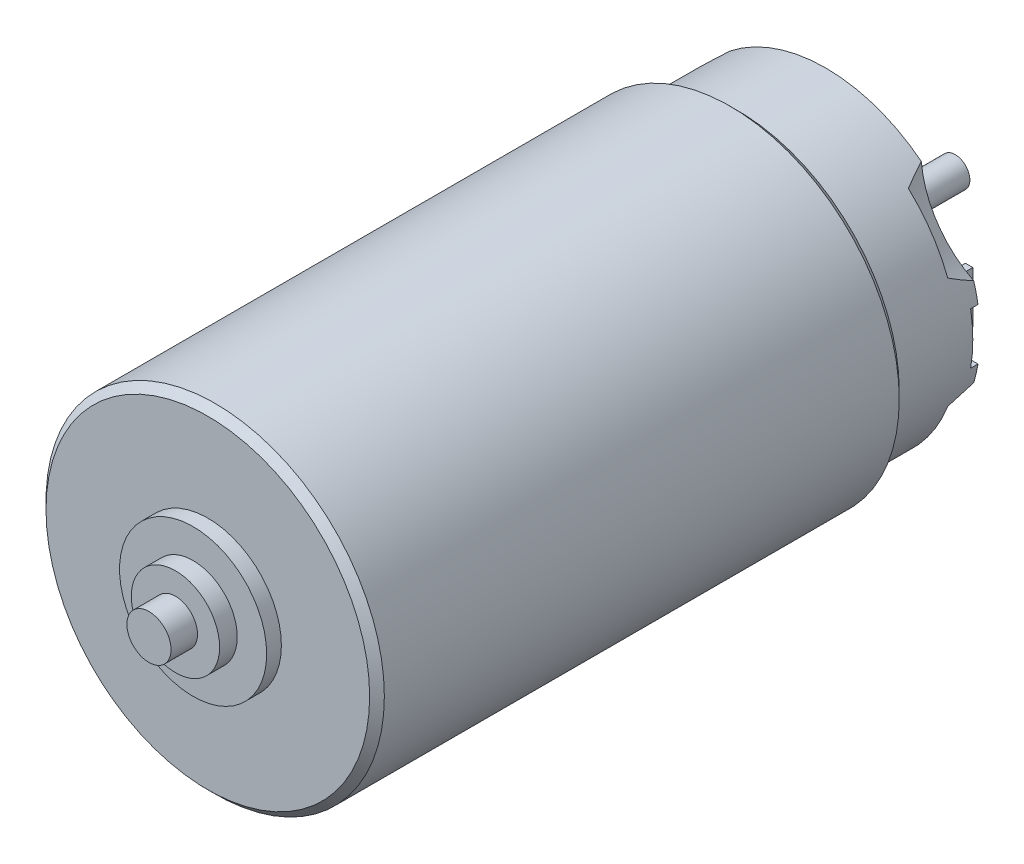
from build123d import *

# Parameters (mm, degrees)
CROQUIS1_R                      = 11.5
SALIENTE_EXTRUIR1_DEPTH         = 36
CROQUIS1_4_R                    = 5
SALIENTE_EXTRUIR2_DEPTH         = 1
CROQUIS1_5_R                    = 3
SALIENTE_EXTRUIR3_DEPTH         = 2.2
CROQUIS1_6_R                    = 1.5
SALIENTE_EXTRUIR4_DEPTH         = 4
CROQUIS3_R                      = 10.5
SALIENTE_EXTRUIR5_DEPTH         = 5
CROQUIS7_R                      = 10.5
SALIENTE_EXTRUIR10_DEPTH        = 1
CROQUIS3_6_R                    = 1
SALIENTE_EXTRUIR7_DEPTH         = 14.8
SALIENTE_EXTRUIR8_START         = 9.1
CROQUIS3_8_R                    = 3
SALIENTE_EXTRUIR8_DEPTH         = 9.1
CROQUIS3_9_R                    = 4.5
SALIENTE_EXTRUIR9_DEPTH         = 7.5
CROQUIS5_W                      = 0.55
CROQUIS5_H                      = 0.6
CORTAR_EXTRUIR1_DEPTH           = 1.5
CORTAR_EXTRUIR1_DRAFT           = -20
CORTAR_EXTRUIR1_PROFILE_2_DEPTH = 1.5
CORTAR_EXTRUIR1_PROFILE_2_DRAFT = -20
CORTAR_EXTRUIR1_PROFILE_3_DEPTH = 1.5
CORTAR_EXTRUIR1_PROFILE_3_DRAFT = -20
CORTAR_EXTRUIR1_PROFILE_4_DEPTH = 1.5
CORTAR_EXTRUIR1_PROFILE_4_DRAFT = -20
CHAFL_N1_SIZE                   = 0.5
CORTAR_EXTRUIR2_START           = -0.5
CORTAR_EXTRUIR2_DEPTH           = 0.5
CROQUIS10_W                     = 0.5
CROQUIS10_H                     = 3.5
SALIENTE_EXTRUIR11_DEPTH        = 2.5


with BuildPart() as part:
    # Croquis1 → Saliente-Extruir1 (new body)
    with BuildSketch(Plane.XY):
        Circle(CROQUIS1_R)
    extrude(amount=-SALIENTE_EXTRUIR1_DEPTH)

    # Croquis1<4> → Saliente-Extruir2 (add)
    with BuildSketch(Plane.XY):
        Circle(CROQUIS1_4_R)
    extrude(amount=SALIENTE_EXTRUIR2_DEPTH)

    # Croquis1<5> → Saliente-Extruir3 (add)
    with BuildSketch(Plane.XY):
        Circle(CROQUIS1_5_R)
    extrude(amount=SALIENTE_EXTRUIR3_DEPTH)

    # Croquis1<6> → Saliente-Extruir4 (add)
    with BuildSketch(Plane.XY):
        Circle(CROQUIS1_6_R)
    extrude(amount=SALIENTE_EXTRUIR4_DEPTH)

    # Croquis3 → Saliente-Extruir5 (add)
    with BuildSketch(Plane(origin=(0, 0, -36), x_dir=(-1, 0, 0), z_dir=(0, 0, -1))):
        Circle(CROQUIS3_R)
    extrude(amount=SALIENTE_EXTRUIR5_DEPTH)

    # Croquis3<6> → Saliente-Extruir7 (add)
    with BuildSketch(Plane(origin=(0, 0, -36), x_dir=(-1, 0, 0), z_dir=(0, 0, -1))):
        Circle(CROQUIS3_6_R)
    extrude(amount=SALIENTE_EXTRUIR7_DEPTH)

    # Croquis3<8> → Saliente-Extruir8 (add)
    with BuildSketch(Plane(origin=(0, 0, -36), x_dir=(-1, 0, 0), z_dir=(0, 0, -1)).offset(SALIENTE_EXTRUIR8_START)):
        with Locations(Location((0, 0, 0), (0, 0, 180))):
            Circle(CROQUIS3_8_R)
    extrude(amount=-SALIENTE_EXTRUIR8_DEPTH)

    # Croquis3<9> → Saliente-Extruir9 (add)
    with BuildSketch(Plane(origin=(0, 0, -36), x_dir=(-1, 0, 0), z_dir=(0, 0, -1))):
        Circle(CROQUIS3_9_R)
    extrude(amount=SALIENTE_EXTRUIR9_DEPTH)

    # Cortar-Barrer1: sweep along a curve in space
    with BuildLine() as cortar_barrer1_path:
        ThreePointArc((-3, 0, -45.1), (-2.121320344, 2.121320344, -45.1), (0, 3, -45.1))
        ThreePointArc((0, 3, -45.1), (2.121320344, 2.121320344, -45.1), (3, 0, -45.1))
        ThreePointArc((3, 0, -45.1), (2.121320344, -2.121320344, -45.1), (0, -3, -45.1))
        ThreePointArc((0, -3, -45.1), (-2.121320344, -2.121320344, -45.1), (-3, 0, -45.1))
    # Croquis5 → Cortar-Barrer1 (sweep, cut)
    with BuildSketch(Plane(origin=(0, 0, 0), x_dir=(0, 0, -1), z_dir=(1, 0, 0))):
        with Locations((43.775, 2.7)):
            Rectangle(CROQUIS5_W, CROQUIS5_H)
    sweep(path=cortar_barrer1_path.line, mode=Mode.SUBTRACT)


with BuildPart() as body_2:
    # Croquis7 → Saliente-Extruir10 (new body)
    with BuildSketch(Plane(origin=(0, 0, -41), x_dir=(-1, 0, 0), z_dir=(0, 0, -1))):
        Circle(CROQUIS7_R)
    extrude(amount=SALIENTE_EXTRUIR10_DEPTH)


with BuildPart() as cortar_extruir1_tool:
    # Croquis8 → Cortar-Extruir1 (with draft: the straight prism first)
    with BuildSketch(Plane(origin=(0, 0, -42), x_dir=(-1, 0, 0), z_dir=(0, 0, -1))):
        with BuildLine():
            ThreePointArc((-6.51000025, -9.479973457), (-7.597986649, -5.15921898), (-11.212760015, -2.554214724))
            ThreePointArc((-11.212760015, -2.554214724), (-9.513968223, -6.460217384), (-6.51000025, -9.479973457))
        make_face()
    extrude(amount=-CORTAR_EXTRUIR1_DEPTH)
    # Cortar-Extruir1: the draft: its side faces are tilted about the plane it starts from
    cortar_extruir1_sides = [cortar_extruir1_tool.faces().sort_by_distance(p)[0] for p in [
        (7.597986649, -5.15921898, -41.25),
        (9.513968223, -6.460217384, -41.25),
    ]]
    draft(cortar_extruir1_sides, Plane(origin=(0, 0, -42), x_dir=(-1, 0, 0), z_dir=(0, 0, -1)), CORTAR_EXTRUIR1_DRAFT)


with BuildPart() as part_1:
    add(part.part)

    # Cortar-Extruir1: cut by cortar_extruir1_tool
    add(cortar_extruir1_tool.part, mode=Mode.SUBTRACT)


with BuildPart() as body_2_1:
    add(body_2.part)

    # Cortar-Extruir1: cut by cortar_extruir1_tool
    add(cortar_extruir1_tool.part, mode=Mode.SUBTRACT)


with BuildPart() as cortar_extruir1_profile_2_tool:
    # Croquis8 → Cortar-Extruir1 profile 2 (with draft: the straight prism first)
    with BuildSketch(Plane(origin=(0, 0, -42), x_dir=(-1, 0, 0), z_dir=(0, 0, -1))):
        with BuildLine():
            ThreePointArc((-6.51000025, 9.479973457), (-9.513968223, 6.460217384), (-11.212760015, 2.554214724))
            ThreePointArc((-11.212760015, 2.554214724), (-7.597986649, 5.15921898), (-6.51000025, 9.479973457))
        make_face()
    extrude(amount=-CORTAR_EXTRUIR1_PROFILE_2_DEPTH)
    # Cortar-Extruir1 profile 2: the draft: its side faces are tilted about the plane it starts from
    cortar_extruir1_profile_2_sides = [cortar_extruir1_profile_2_tool.faces().sort_by_distance(p)[0] for p in [
        (9.513968223, 6.460217384, -41.25),
        (7.597986649, 5.15921898, -41.25),
    ]]
    draft(cortar_extruir1_profile_2_sides, Plane(origin=(0, 0, -42), x_dir=(-1, 0, 0), z_dir=(0, 0, -1)), CORTAR_EXTRUIR1_PROFILE_2_DRAFT)


with BuildPart() as part_2:
    add(part_1.part)

    # Cortar-Extruir1 profile 2: cut by cortar_extruir1_profile_2_tool
    add(cortar_extruir1_profile_2_tool.part, mode=Mode.SUBTRACT)


with BuildPart() as body_2_2:
    add(body_2_1.part)

    # Cortar-Extruir1 profile 2: cut by cortar_extruir1_profile_2_tool
    add(cortar_extruir1_profile_2_tool.part, mode=Mode.SUBTRACT)


with BuildPart() as cortar_extruir1_profile_3_tool:
    # Croquis8 → Cortar-Extruir1 profile 3 (with draft: the straight prism first)
    with BuildSketch(Plane(origin=(0, 0, -42), x_dir=(-1, 0, 0), z_dir=(0, 0, -1))):
        with BuildLine():
            ThreePointArc((6.51000025, 9.479973457), (7.597986649, 5.15921898), (11.212760015, 2.554214724))
            ThreePointArc((11.212760015, 2.554214724), (9.513968223, 6.460217384), (6.51000025, 9.479973457))
        make_face()
    extrude(amount=-CORTAR_EXTRUIR1_PROFILE_3_DEPTH)
    # Cortar-Extruir1 profile 3: the draft: its side faces are tilted about the plane it starts from
    cortar_extruir1_profile_3_sides = [cortar_extruir1_profile_3_tool.faces().sort_by_distance(p)[0] for p in [
        (-9.513968223, 6.460217384, -41.25),
        (-7.597986649, 5.15921898, -41.25),
    ]]
    draft(cortar_extruir1_profile_3_sides, Plane(origin=(0, 0, -42), x_dir=(-1, 0, 0), z_dir=(0, 0, -1)), CORTAR_EXTRUIR1_PROFILE_3_DRAFT)


with BuildPart() as part_3:
    add(part_2.part)

    # Cortar-Extruir1 profile 3: cut by cortar_extruir1_profile_3_tool
    add(cortar_extruir1_profile_3_tool.part, mode=Mode.SUBTRACT)


with BuildPart() as body_2_3:
    add(body_2_2.part)

    # Cortar-Extruir1 profile 3: cut by cortar_extruir1_profile_3_tool
    add(cortar_extruir1_profile_3_tool.part, mode=Mode.SUBTRACT)


with BuildPart() as cortar_extruir1_profile_4_tool:
    # Croquis8 → Cortar-Extruir1 profile 4 (with draft: the straight prism first)
    with BuildSketch(Plane(origin=(0, 0, -42), x_dir=(-1, 0, 0), z_dir=(0, 0, -1))):
        with BuildLine():
            ThreePointArc((6.51000025, -9.479973457), (9.513968223, -6.460217384), (11.212760015, -2.554214724))
            ThreePointArc((11.212760015, -2.554214724), (7.597986649, -5.15921898), (6.51000025, -9.479973457))
        make_face()
    extrude(amount=-CORTAR_EXTRUIR1_PROFILE_4_DEPTH)
    # Cortar-Extruir1 profile 4: the draft: its side faces are tilted about the plane it starts from
    cortar_extruir1_profile_4_sides = [cortar_extruir1_profile_4_tool.faces().sort_by_distance(p)[0] for p in [
        (-7.597986649, -5.15921898, -41.25),
        (-9.513968223, -6.460217384, -41.25),
    ]]
    draft(cortar_extruir1_profile_4_sides, Plane(origin=(0, 0, -42), x_dir=(-1, 0, 0), z_dir=(0, 0, -1)), CORTAR_EXTRUIR1_PROFILE_4_DRAFT)


with BuildPart() as part_4:
    add(part_3.part)

    # Cortar-Extruir1 profile 4: cut by cortar_extruir1_profile_4_tool
    add(cortar_extruir1_profile_4_tool.part, mode=Mode.SUBTRACT)

    # Chaflán1
    chafl_n1_edges = [part_4.edges().sort_by_distance(p)[0] for p in [
        (-11.5, 0, 0),
        (-11.5, 0, -36),
    ]]
    chamfer(chafl_n1_edges, length=CHAFL_N1_SIZE)



with BuildPart() as body_2_4:
    add(body_2_3.part)

    # Cortar-Extruir1 profile 4: cut by cortar_extruir1_profile_4_tool
    add(cortar_extruir1_profile_4_tool.part, mode=Mode.SUBTRACT)

    # Croquis9 → Cortar-Extruir2 (cut)
    with BuildSketch(Plane(origin=(0, 0, -42), x_dir=(-1, 0, 0), z_dir=(0, 0, -1)).offset(CORTAR_EXTRUIR2_START)):
        with BuildLine():
            Line((-10.35313962, -1.75), (-8, -1.75))
            Line((-8, -1.75), (-7.5, -1.75))
            Line((-7.5, -1.75), (-7.5, 1.75))
            Line((-7.5, 1.75), (-8, 1.75))
            Line((-8, 1.75), (-10.35313962, 1.75))
            ThreePointArc((-10.35313962, 1.75), (-10.463220489, 0.878075733), (-10.5, 0))
            ThreePointArc((-10.5, 0), (-10.463220489, -0.878075733), (-10.35313962, -1.75))
        make_face()
        with BuildLine():
            Line((7.5, -1.75), (8, -1.75))
            Line((8, -1.75), (10.35313962, -1.75))
            ThreePointArc((10.35313962, -1.75), (10.463220489, -0.878075733), (10.5, 0))
            ThreePointArc((10.5, 0), (10.463220489, 0.878075733), (10.35313962, 1.75))
            Line((10.35313962, 1.75), (8, 1.75))
            Line((8, 1.75), (7.5, 1.75))
            Line((7.5, 1.75), (7.5, -1.75))
        make_face()
    extrude(amount=CORTAR_EXTRUIR2_DEPTH, mode=Mode.SUBTRACT)


with BuildPart() as part_5:
    add(part_4.part)

    add(body_2_4.part)  # Saliente-Extruir11 merges body 2
    # Croquis10 → Saliente-Extruir11 (add)
    with BuildSketch(Plane(origin=(0, 0, -41.5), x_dir=(-1, 0, 0), z_dir=(0, 0, -1))):
        with Locations((7.75, 0)):
            Rectangle(CROQUIS10_W, CROQUIS10_H)
        with Locations((-7.75, 0)):
            Rectangle(CROQUIS10_W, CROQUIS10_H)
    extrude(amount=SALIENTE_EXTRUIR11_DEPTH)


solid = part_5.part
